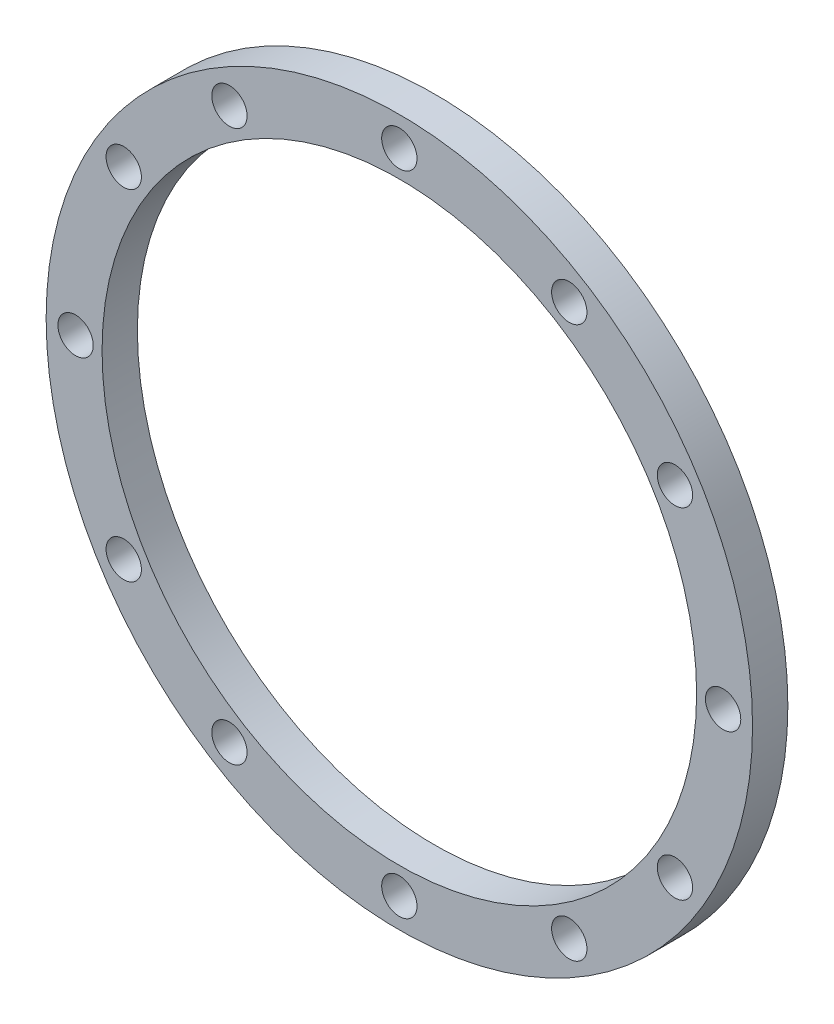
from build123d import *

# Parameters (mm, degrees)
IZIM1_R                     = 300
IZIM1_R_2                   = 252.5
Y_KSEKLIK_EKSTR_ZYON1_DEPTH = 30
IZIM2_R                     = 15
KES_EKSTR_ZYON1_DEPTH       = 30


with BuildPart() as part:
    # Çizim1 → Yükseklik-Ekstrüzyon1 (new body)
    with BuildSketch(Plane.XY):
        Circle(IZIM1_R)
        Circle(IZIM1_R_2, mode=Mode.SUBTRACT)
    extrude(amount=Y_KSEKLIK_EKSTR_ZYON1_DEPTH)

    # Çizim2 → Kes-Ekstrüzyon1 (cut)
    with BuildSketch(Plane.XY.offset(30)):
        with Locations((0, 275)):
            Circle(IZIM2_R)
        with Locations((275, 0)):
            Circle(IZIM2_R)
        with Locations((-275, 0)):
            Circle(IZIM2_R)
        with Locations((0, -275)):
            Circle(IZIM2_R)
        with Locations((-144.313707876, -234.090909091)):
            Circle(IZIM2_R)
        with Locations((-234.090909091, -144.313707876)):
            Circle(IZIM2_R)
        with Locations((-234.090909091, 144.313707876)):
            Circle(IZIM2_R)
        with Locations((144.313707876, -234.090909091)):
            Circle(IZIM2_R)
        with Locations((234.090909091, -144.313707876)):
            Circle(IZIM2_R)
        with Locations((234.090909091, 144.313707876)):
            Circle(IZIM2_R)
        with Locations((-144.313707876, 234.090909091)):
            Circle(IZIM2_R)
        with Locations((144.313707876, 234.090909091)):
            Circle(IZIM2_R)
    extrude(amount=-KES_EKSTR_ZYON1_DEPTH, mode=Mode.SUBTRACT)


solid = part.part
